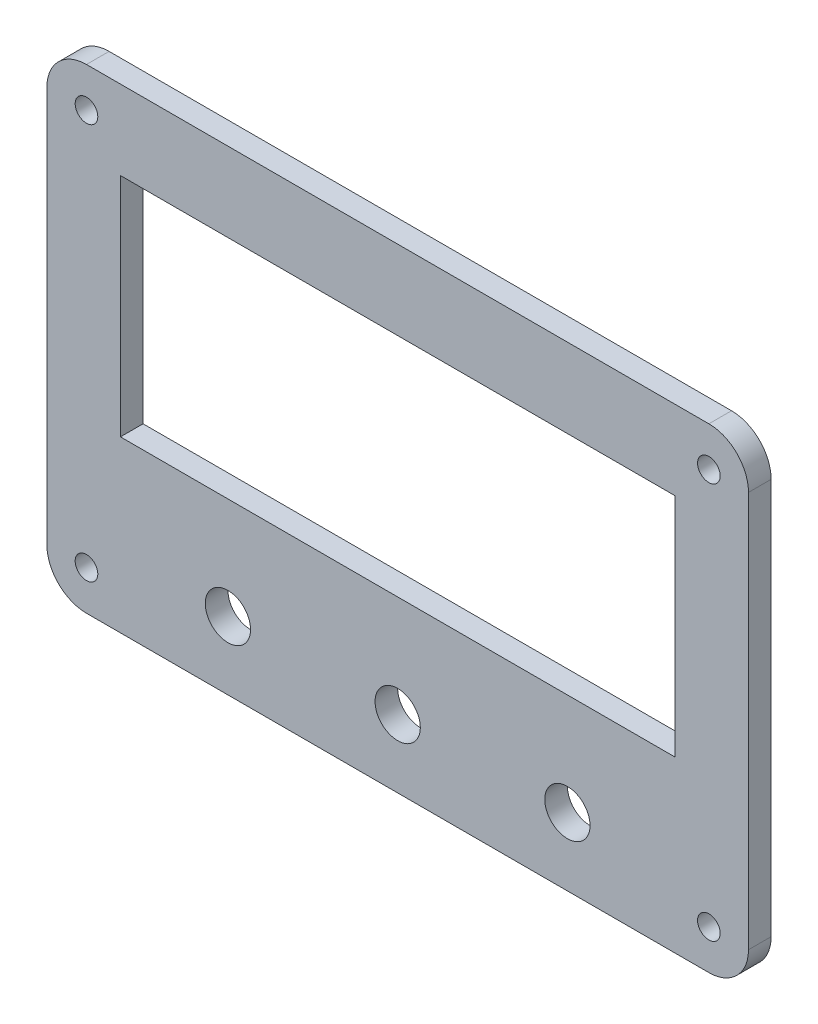
from build123d import *

# Parameters (mm, degrees)
CROQUIS1_W              = 124
CROQUIS1_H              = 84
CROQUIS1_R              = 2
CROQUIS1_R_2            = 4
CROQUIS1_W_2            = 98
CROQUIS1_H_2            = 40
SALIENTE_EXTRUIR1_DEPTH = 4
REDONDEO1_R             = 7


with BuildPart() as part:
    # Croquis1 → Saliente-Extruir1 (new body)
    with BuildSketch(Plane.XY):
        with Locations((62, 42)):
            Rectangle(CROQUIS1_W, CROQUIS1_H)
        with Locations((7, 77)):
            Circle(CROQUIS1_R, mode=Mode.SUBTRACT)
        with Locations((117, 77)):
            Circle(CROQUIS1_R, mode=Mode.SUBTRACT)
        with Locations((117, 7)):
            Circle(CROQUIS1_R, mode=Mode.SUBTRACT)
        with Locations((7, 7)):
            Circle(CROQUIS1_R, mode=Mode.SUBTRACT)
        with Locations((32, 12)):
            Circle(CROQUIS1_R_2, mode=Mode.SUBTRACT)
        with Locations((62, 12)):
            Circle(CROQUIS1_R_2, mode=Mode.SUBTRACT)
        with Locations((92, 12)):
            Circle(CROQUIS1_R_2, mode=Mode.SUBTRACT)
        with Locations((62, 50)):
            Rectangle(CROQUIS1_W_2, CROQUIS1_H_2, mode=Mode.SUBTRACT)
    extrude(amount=SALIENTE_EXTRUIR1_DEPTH)

    # Redondeo1
    redondeo1_edges = [part.edges().sort_by_distance(p)[0] for p in [
        (0, 84, 2),
        (124, 84, 2),
        (124, 0, 2),
        (0, 0, 2),
    ]]
    fillet(redondeo1_edges, radius=REDONDEO1_R)


solid = part.part
